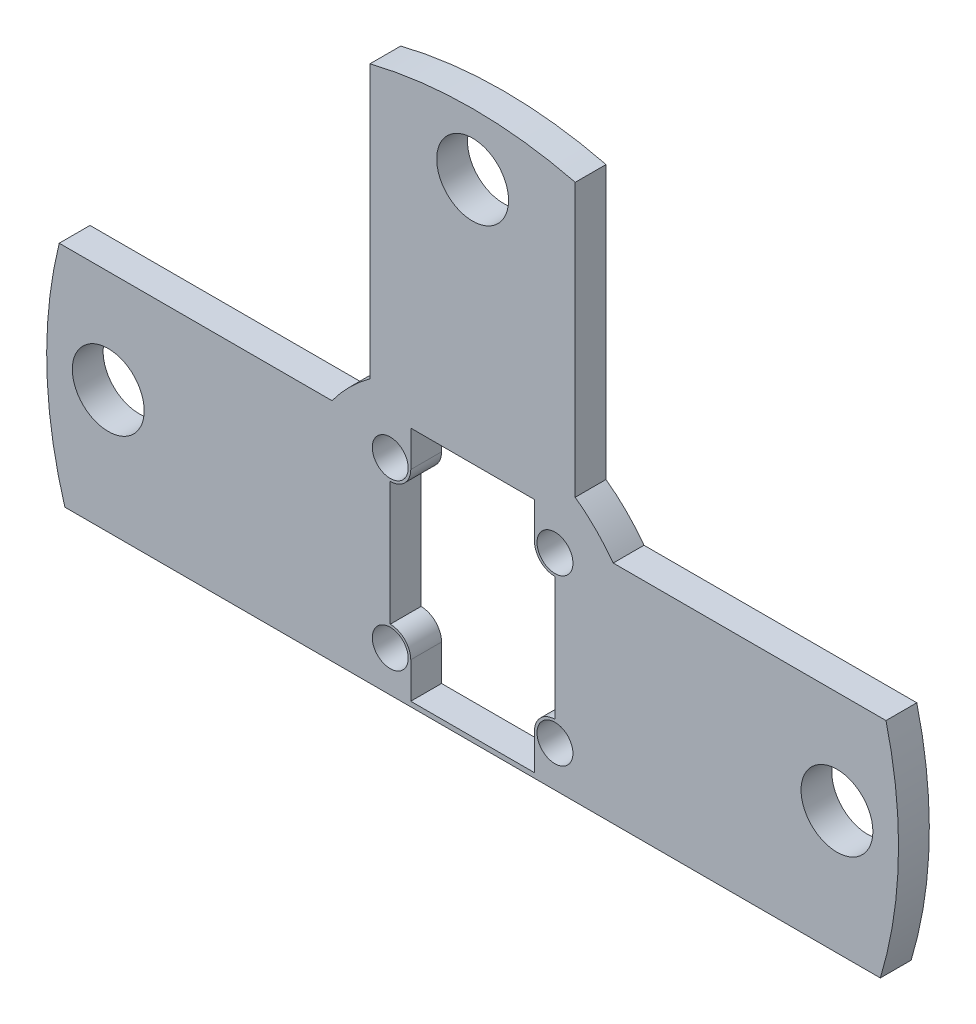
from build123d import *

# Parameters (mm, degrees)
CROQUIS1_R              = 3.5
SALIENTE_EXTRUIR1_DEPTH = 52.5
SALIENTE_EXTRUIR2_START = -3
CROQUIS2_R              = 29.5
CROQUIS2_R_2            = 1.75
SALIENTE_EXTRUIR2_DEPTH = 3
CORTAR_EXTRUIR1_DEPTH   = 79.744841101
CORTAR_EXTRUIR2_DEPTH   = 79.744841101
CORTAR_EXTRUIR3_DEPTH   = 79.744841101
CROQUIS7_W              = 12.05
CROQUIS7_H              = 3.5
CORTAR_EXTRUIR4_DEPTH   = 79.744841101
CROQUIS8_W              = 98.89383178
CROQUIS8_H              = 87.653821396
CORTAR_EXTRUIR5_DEPTH   = 49.5


with BuildPart() as part:
    # Croquis1 → Saliente-Extruir1 (new body)
    with BuildSketch(Plane.XY):
        with BuildLine():
            Line((-39.727194716, -12), (-26.949025956, -12))
            ThreePointArc((-26.949025956, -12), (0, 29.5), (26.949025956, -12))
            Line((26.949025956, -12), (39.727194716, -12))
            ThreePointArc((39.727194716, -12), (0, 41.5), (-39.727194716, -12))
        make_face()
        with Locations((-35.5, 0)):
            Circle(CROQUIS1_R, mode=Mode.SUBTRACT)
        with Locations((0, 35.5)):
            Circle(CROQUIS1_R, mode=Mode.SUBTRACT)
        with Locations((35.5, 0)):
            Circle(CROQUIS1_R, mode=Mode.SUBTRACT)
    extrude(amount=SALIENTE_EXTRUIR1_DEPTH)

    # Croquis2 → Saliente-Extruir2 (add)
    with BuildSketch(Plane.XY.offset(52.5).offset(SALIENTE_EXTRUIR2_START)):
        Circle(CROQUIS2_R)
        with Locations((-8.025, 8.025)):
            Circle(CROQUIS2_R_2, mode=Mode.SUBTRACT)
        with Locations((8.025, 8.025)):
            Circle(CROQUIS2_R_2, mode=Mode.SUBTRACT)
        with Locations((-8.025, -8.025)):
            Circle(CROQUIS2_R_2, mode=Mode.SUBTRACT)
        with Locations((8.025, -8.025)):
            Circle(CROQUIS2_R_2, mode=Mode.SUBTRACT)
    extrude(amount=SALIENTE_EXTRUIR2_DEPTH)

    # Croquis3 → Cortar-Extruir1 (cut, through all)
    with BuildSketch(Plane.XY.offset(52.5)):
        with BuildLine():
            Line((-8.025, 6.025), (-8.025, -6.025))
            ThreePointArc((-8.025, -6.025), (-6.610786438, -6.610786438), (-6.025, -8.025))
            Line((-6.025, -8.025), (6.025, -8.025))
            ThreePointArc((6.025, -8.025), (6.610786438, -6.610786438), (8.025, -6.025))
            Line((8.025, -6.025), (8.025, 6.025))
            ThreePointArc((8.025, 6.025), (6.610786438, 6.610786438), (6.025, 8.025))
            Line((6.025, 8.025), (-6.025, 8.025))
            ThreePointArc((-6.025, 8.025), (-6.610786438, 6.610786438), (-8.025, 6.025))
        make_face()
    extrude(amount=-CORTAR_EXTRUIR1_DEPTH, mode=Mode.SUBTRACT)

    # Croquis5 → Cortar-Extruir2 (cut, through all)
    with BuildSketch(Plane.XY.offset(52.5)):
        Polygon((-26.949025956, -12), (26.949025956, -12), (26.949025956, -33.158311757), (-29.290832667, -29.730661126), align=None)
    extrude(amount=-CORTAR_EXTRUIR2_DEPTH, mode=Mode.SUBTRACT)

    # Croquis6 → Cortar-Extruir3 (cut, through all)
    with BuildSketch(Plane.XY.offset(52.5)):
        with BuildLine():
            Line((-40.277164746, 10), (-13.698766072, 10))
            ThreePointArc((-13.698766072, 10), (-11.992835192, 11.992835192), (-10, 13.698766072))
            Line((-10, 13.698766072), (-10, 40.277164746))
            ThreePointArc((-10, 40.277164746), (-29.344931419, 29.344931419), (-40.277164746, 10))
        make_face()
        with BuildLine():
            Line((10, 13.698766072), (10, 40.277164746))
            ThreePointArc((10, 40.277164746), (29.344931419, 29.344931419), (40.277164746, 10))
            Line((40.277164746, 10), (13.698766072, 10))
            ThreePointArc((13.698766072, 10), (11.992835192, 11.992835192), (10, 13.698766072))
        make_face()
    extrude(amount=-CORTAR_EXTRUIR3_DEPTH, mode=Mode.SUBTRACT)

    # Croquis7 → Cortar-Extruir4 (cut, through all)
    with BuildSketch(Plane.XY.offset(52.5)):
        with Locations((0, 9.775)):
            Rectangle(CROQUIS7_W, CROQUIS7_H)
        with Locations((0, -9.775)):
            Rectangle(CROQUIS7_W, CROQUIS7_H)
    extrude(amount=-CORTAR_EXTRUIR4_DEPTH, mode=Mode.SUBTRACT)

    # Croquis8 → Cortar-Extruir5 (cut)
    with BuildSketch(Plane(origin=(0, 0, 0), x_dir=(-1, 0, 0), z_dir=(0, 0, -1))):
        Rectangle(CROQUIS8_W, CROQUIS8_H)
    extrude(amount=-CORTAR_EXTRUIR5_DEPTH, mode=Mode.SUBTRACT)


solid = part.part
